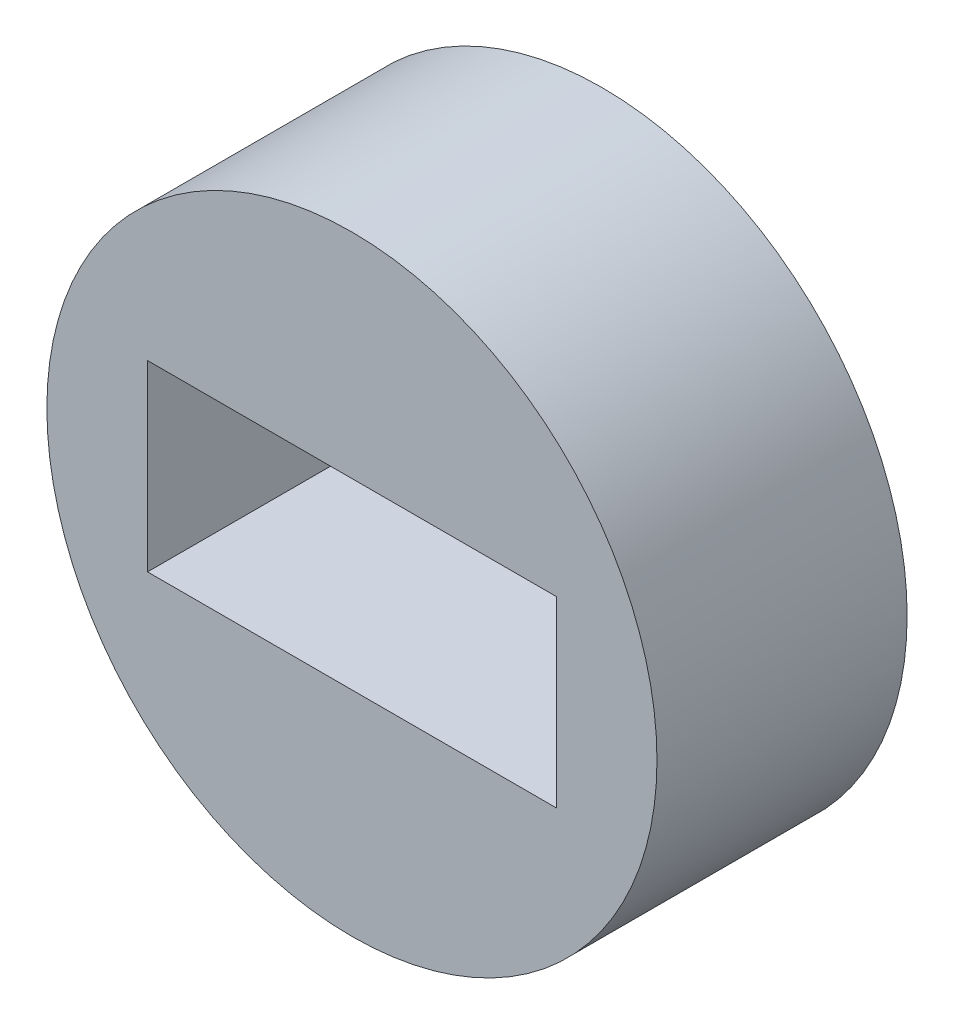
from build123d import *

# Parameters (mm, degrees)
SKETCH1_R           = 50
BOSS_EXTRUDE1_DEPTH = 41
SKETCH2_W           = 67
SKETCH2_H           = 30
CUT_EXTRUDE1_DEPTH  = 41


with BuildPart() as part:
    # Sketch1 → Boss-Extrude1 (new body)
    with BuildSketch(Plane.XY):
        Circle(SKETCH1_R)
    extrude(amount=BOSS_EXTRUDE1_DEPTH)

    # Sketch2 → Cut-Extrude1 (cut)
    with BuildSketch(Plane.XY.offset(41)):
        Rectangle(SKETCH2_W, SKETCH2_H)
    extrude(amount=-CUT_EXTRUDE1_DEPTH, mode=Mode.SUBTRACT)


solid = part.part
